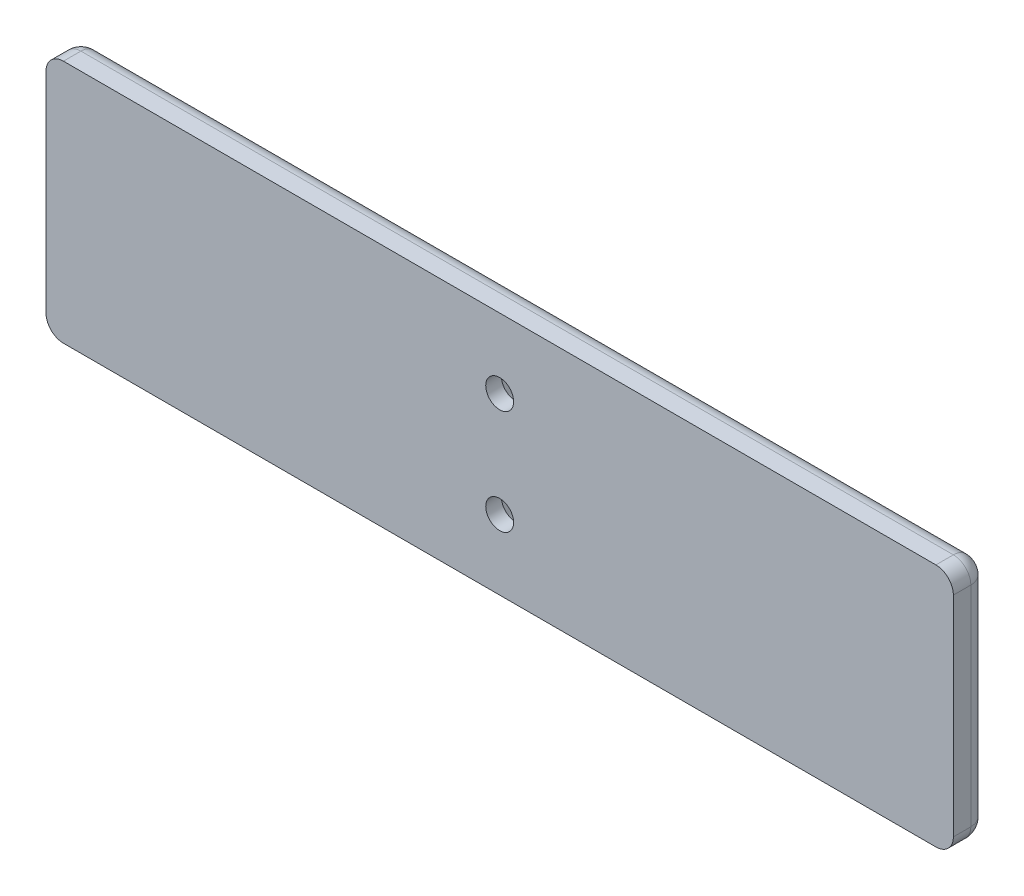
from build123d import *

# Parameters (mm, degrees)
SKETCH_1_W      = 52
SKETCH_1_H      = 14
EXTRUDE_1_DEPTH = 2
FILLET_2_R      = 1


with BuildPart() as part:
    # 草图1 → 凸台-拉伸1 (new body)
    with BuildSketch(Plane.XY):
        with Locations((26, 7)):
            Rectangle(SKETCH_1_W, SKETCH_1_H)
    extrude(amount=EXTRUDE_1_DEPTH)

    # 圆角2
    fillet_2_edges = [part.edges().sort_by_distance(p)[0] for p in [
        (26, 0, 0),
        (0, 7, 0),
        (26, 14, 0),
        (52, 7, 0),
        (52, 0, 1),
        (0, 0, 1),
        (0, 14, 1),
        (52, 14, 1),
    ]]
    fillet(fillet_2_edges, radius=FILLET_2_R)

    # 草图6 → 切除-旋转4 (revolve, cut)
    with BuildSketch(Plane(origin=(26, 0, 0), x_dir=(0, 0, -1), z_dir=(1, 0, 0)), mode=Mode.PRIVATE) as cut_revolve_4_sk:
        Polygon((0, 10), (0, 11.4), (-1.1, 10.8), (-2, 10.8), (-2, 10), align=None)
    revolve(cut_revolve_4_sk.sketch.rotate(Axis((26, 10, 0), (0, 0, 1)), 90), axis=Axis((26, 10, 0), (0, 0, 1)), mode=Mode.SUBTRACT)

    # 草图5 → 切除-旋转5 (revolve, cut)
    with BuildSketch(Plane(origin=(26, 0, 0), x_dir=(0, 0, -1), z_dir=(1, 0, 0)), mode=Mode.PRIVATE) as cut_revolve_5_sk:
        Polygon((0, 4), (0, 2.6), (-1.1, 3.2), (-2, 3.2), (-2, 4), align=None)
    revolve(cut_revolve_5_sk.sketch.rotate(Axis((26, 4, 0), (0, 0, 1)), 180), axis=Axis((26, 4, 0), (0, 0, 1)), mode=Mode.SUBTRACT)


solid = part.part
